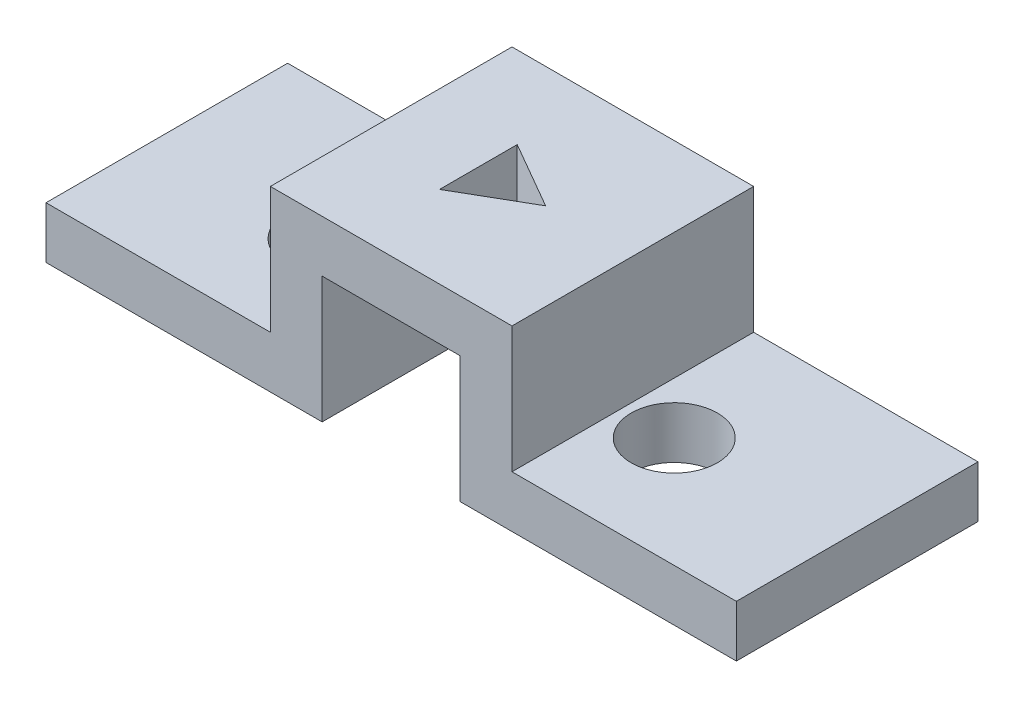
from build123d import *

# Parameters (mm, degrees)
BOSS_EXTRUDE1_DEPTH = 7
CUT_EXTRUDE1_REACH  = 15.252
SKETCH2_R           = 1.25
CUT_EXTRUDE2_REACH  = 14.743


with BuildPart() as part:
    # Sketch1 → Boss-Extrude1 (new body)
    with BuildSketch(Plane.XY):
        Polygon((-10, -3.659090909), (-2, -3.659090909), (-2, 0), (2, 0), (2, -3.659090909), (10, -3.659090909), (10, -2.159090909), (3.5, -2.159090909), (3.5, 1.5), (-3.5, 1.5), (-3.5, -2.159090909), (-10, -2.159090909), align=None)
    extrude(amount=BOSS_EXTRUDE1_DEPTH)

    # Sketch2 → Cut-Extrude1 (cut, up to next)
    with BuildSketch(Plane.XZ.offset(3.659090909), mode=Mode.PRIVATE) as cut_extrude1_sk1:
        with Locations(Location((5.000786438, 3.8, 0), (0, 0, 270))):
            Circle(SKETCH2_R)
    cut_extrude1_tool1 = extrude(cut_extrude1_sk1.sketch, amount=-CUT_EXTRUDE1_REACH, mode=Mode.PRIVATE) & part.part
    cut_extrude1 = cut_extrude1_tool1.solids().sort_by_distance((5.000786, -3.659091, 3.8))[0]
    add(cut_extrude1, mode=Mode.SUBTRACT)

    # Mirror1: Cut-Extrude1 across plane
    add(cut_extrude1.mirror(Plane.ZY), mode=Mode.SUBTRACT)

    # Sketch3 → Cut-Extrude2 (cut, up to next)
    with BuildSketch(Plane.XZ, mode=Mode.PRIVATE) as cut_extrude2_sk1:
        Polygon((0.974278579, 3.5), (-0.974278579, 4.625), (-0.974278579, 2.375), align=None)
    cut_extrude2_tool1 = extrude(cut_extrude2_sk1.sketch, amount=-CUT_EXTRUDE2_REACH, mode=Mode.PRIVATE) & part.part
    add(cut_extrude2_tool1.solids().sort_by_distance((-0.32476, 0, 3.5))[0], mode=Mode.SUBTRACT)


solid = part.part
